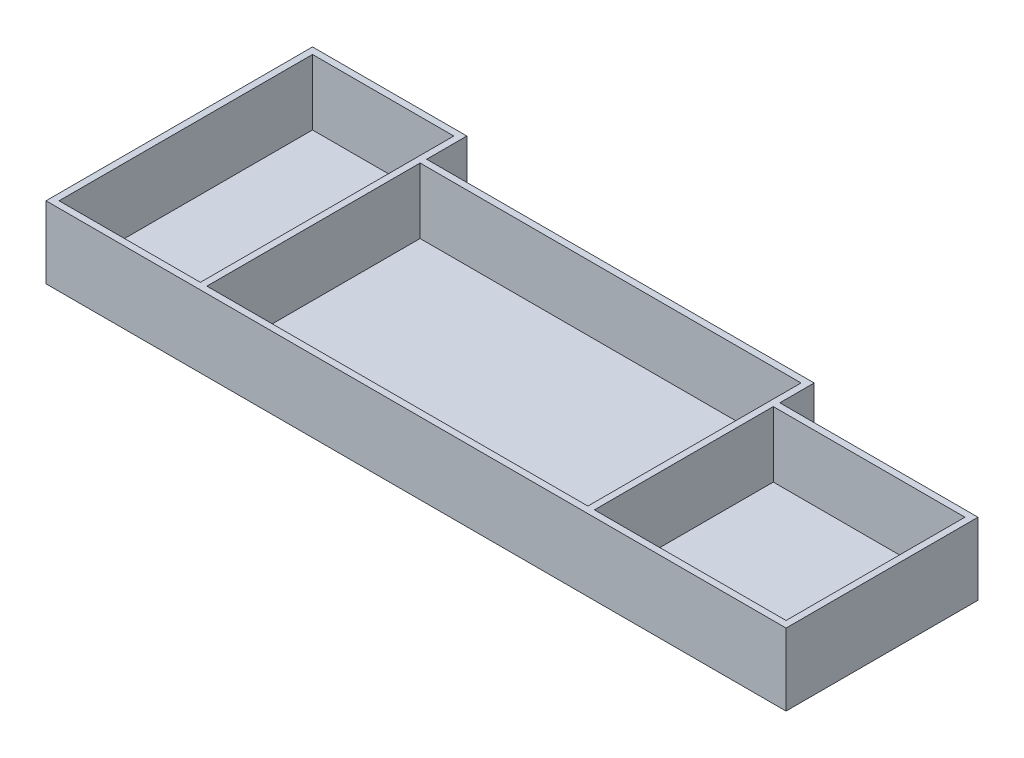
from build123d import *

# Parameters (mm, degrees)
BOSS_EXTRUDE1_DEPTH = 2
SKETCH1_4_W         = 58.6
SKETCH1_4_H         = 54.7
BOSS_EXTRUDE2_DEPTH = 20


with BuildPart() as part:
    # Sketch1 → Boss-Extrude1 (new body)
    with BuildSketch(Plane(origin=(0, 0, 0), x_dir=(1, 0, 0), z_dir=(0, 1, 0))):
        Polygon((0, 0), (224.3, 0), (226.3, 0), (226.3, 58.7), (165.7, 58.7), (165.7, 69.2), (47.2, 69.2), (47.2, 81.5), (0, 81.5), align=None)
    extrude(amount=-BOSS_EXTRUDE1_DEPTH)

    # Sketch1<4> → Boss-Extrude2 (add)
    with BuildSketch(Plane(origin=(0, 0, 0), x_dir=(1, 0, 0), z_dir=(0, 1, 0))):
        Polygon((0, 2), (0, 0), (2, 0), (44.2, 0), (46.2, 0), (162.7, 0), (164.7, 0), (224.3, 0), (226.3, 0), (226.3, 58.7), (165.7, 58.7), (165.7, 69.2), (47.2, 69.2), (47.2, 81.5), (2, 81.5), (0, 81.5), (0, 79.5), align=None)
        Polygon((163.7, 2), (47.2, 2), (47.2, 67.2), (163.7, 67.2), (163.7, 55.7), (163.7, 53.7), align=None, mode=Mode.SUBTRACT)
        with Locations((195, 29.35)):
            Rectangle(SKETCH1_4_W, SKETCH1_4_H, mode=Mode.SUBTRACT)
        Polygon((2, 2), (2, 79.5), (45.2, 79.5), (45.2, 68.2), (45.2, 66.2), (45.2, 2), align=None, mode=Mode.SUBTRACT)
    extrude(amount=BOSS_EXTRUDE2_DEPTH)


solid = part.part
